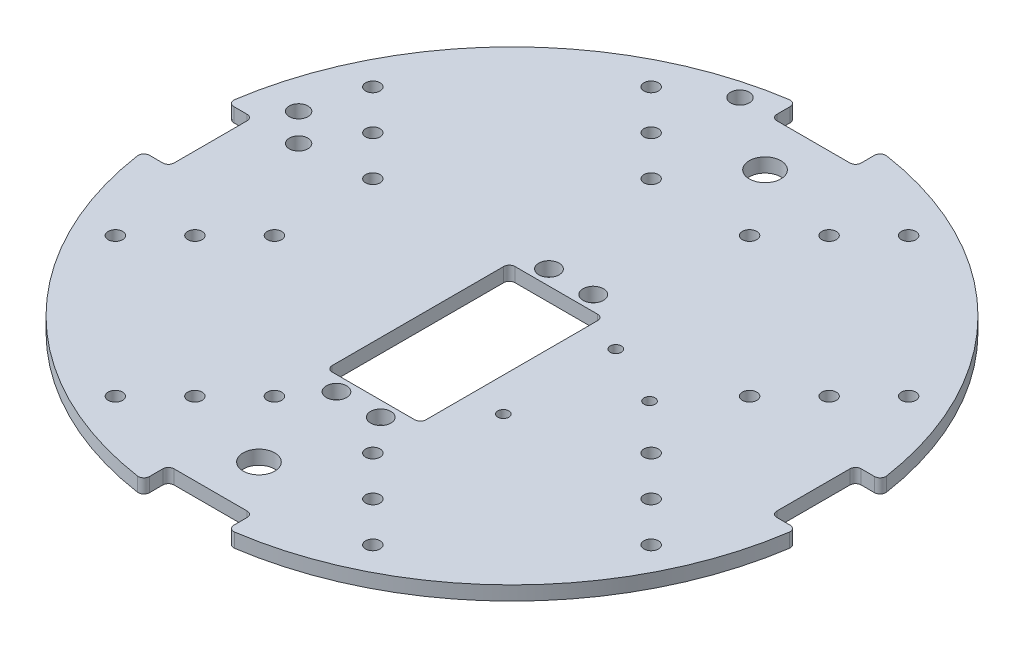
from build123d import *

# Parameters (mm, degrees)
SKETCH1_R                       = 74.422
SKETCH1_W                       = 21.200000018
SKETCH1_H                       = 41.29999995
BOSS_EXTRUDE1_DEPTH             = 3.175
F_4_6_4_6_DIAMETER_HOLE1_D      = 4.6
F_4_CLEARANCE_HOLE1_D           = 3.2639
CIRPATTERN2_COUNT               = 4
F_1_4_CLEARANCE_HOLE1_D         = 7.14248
SKETCH19_W                      = 19.05
SKETCH19_H                      = 12.7
CUT_EXTRUDE1_DEPTH              = 106.29648044
CIRPATTERN3_COUNT               = 4
FILLET1_R                       = 1.27
F_19_0_166_DIAMETER_HOLE1_D     = 4.2164
TAP_DRILL_FOR_M3X0_5_TAP1_D     = 2.5
TAP_DRILL_FOR_M3X0_5_TAP1_DEPTH = 3.81
TAP_DRILL_FOR_M3X0_5_TAP1_TIP   = 0.751075774


with BuildPart() as part:
    # Sketch1 → Boss-Extrude1 (new body)
    with BuildSketch(Plane(origin=(0, 0, 0), x_dir=(1, 0, 0), z_dir=(0, 1, 0))):
        with Locations(Location((0, 0, 0), (0, 0, 270))):
            Circle(SKETCH1_R)
        with Locations((0, -10.649999909)):
            Rectangle(SKETCH1_W, SKETCH1_H, mode=Mode.SUBTRACT)
    extrude(amount=BOSS_EXTRUDE1_DEPTH)

    # Ø4.6 (4.6) Diameter Hole1 (through all)
    with Locations(Plane(origin=(0, 0, 0), x_dir=(-1, 0, 0), z_dir=(0, -1, 0))):
        with Locations((-5.000000033, 13.350000097), (4.999999906, 13.350000097), (-5.000000033, -34.649999915), (4.999999906, -34.649999915)):
            Hole(F_4_6_4_6_DIAMETER_HOLE1_D / 2)

    # #4 Clearance Hole1 (through all)
    with Locations(Plane(origin=(0, 0, 0), x_dir=(-1, 0, 0), z_dir=(0, -1, 0))):
        with Locations((60.506475165, -29.075578741), (29.075578741, -60.506475165), (11.115066499, -42.545962923), (20.09532262, -51.526219044), (51.526219044, -20.09532262), (42.545962923, -11.115066499)):
            f_4_clearance_hole1 = Hole(F_4_CLEARANCE_HOLE1_D / 2)

    # CirPattern2: #4 Clearance Hole1 ×4 about axis
    cirpattern2_axis = Axis((0, 0, 0), (0, 1, 0))
    for i in range(1, CIRPATTERN2_COUNT):
        add(f_4_clearance_hole1.rotate(cirpattern2_axis, i * 360 / CIRPATTERN2_COUNT), mode=Mode.SUBTRACT)

    # 1/4 Clearance Hole1 (through all)
    with Locations(Plane(origin=(0, 3.175, 0), x_dir=(1, 0, 0), z_dir=(0, 1, 0))):
        with Locations((0, 57.15), (0, -57.15)):
            Hole(F_1_4_CLEARANCE_HOLE1_D / 2)

    # Sketch19 → Cut-Extrude1 (cut, through all)
    with BuildSketch(Plane.XZ):
        with Locations((0, -74.422)):
            Rectangle(SKETCH19_W, SKETCH19_H)
    cut_extrude1 = extrude(amount=-CUT_EXTRUDE1_DEPTH, mode=Mode.SUBTRACT)

    # CirPattern3: Cut-Extrude1 ×4 about axis
    cirpattern3_axis = Axis((0, 0, 0), (0, 1, 0))
    for i in range(1, CIRPATTERN3_COUNT):
        add(cut_extrude1.rotate(cirpattern3_axis, i * 360 / CIRPATTERN3_COUNT), mode=Mode.SUBTRACT)

    # Fillet1
    fillet1_edges = [part.edges().sort_by_distance(p)[0] for p in [
        (-9.525, 1.5875, -73.809948239),
        (9.525, 1.5875, -73.809948239),
        (9.525, 1.5875, -68.072),
        (-9.525, 1.5875, -68.072),
        (73.809948239, 1.5875, -9.525),
        (73.809948239, 1.5875, 9.525),
        (9.525, 1.5875, 73.809948239),
        (-9.525, 1.5875, 73.809948239),
        (-73.809948239, 1.5875, 9.525),
        (-73.809948239, 1.5875, -9.525),
        (-68.072, 1.5875, -9.525),
        (-68.072, 1.5875, 9.525),
        (-9.525, 1.5875, 68.072),
        (9.525, 1.5875, 68.072),
        (68.072, 1.5875, 9.525),
        (68.072, 1.5875, -9.525),
        (10.600000009, 1.5875, 31.299999884),
        (10.600000009, 1.5875, -10.000000066),
        (-10.600000009, 1.5875, -10.000000066),
        (-10.600000009, 1.5875, 31.299999884),
    ]]
    fillet(fillet1_edges, radius=FILLET1_R)

    # #19 (0.166) Diameter Hole1 (through all)
    with Locations(Plane(origin=(0, 3.175, 0), x_dir=(1, 0, 0), z_dir=(0, 1, 0))):
        with Locations((-16.963217712, 68.448703271), (-64.109562348, 15.914204963), (-57.823383063, 9.628025678)):
            Hole(F_19_0_166_DIAMETER_HOLE1_D / 2)

    # Tap Drill for M3x0.5 Tap1
    with Locations(Plane(origin=(0, 3.175, 0), x_dir=(1, 0, 0), z_dir=(0, 1, 0))):
        with Locations((18.220000103, 5.225000097), (18.220000103, -20.174999903), (32.190000103, -1.124999903)):
            Hole(TAP_DRILL_FOR_M3X0_5_TAP1_D / 2, depth=TAP_DRILL_FOR_M3X0_5_TAP1_DEPTH)
            with Locations((0, 0, -(TAP_DRILL_FOR_M3X0_5_TAP1_DEPTH + TAP_DRILL_FOR_M3X0_5_TAP1_TIP / 2))):  # 118° drill point
                Cone(0, TAP_DRILL_FOR_M3X0_5_TAP1_D / 2, TAP_DRILL_FOR_M3X0_5_TAP1_TIP, mode=Mode.SUBTRACT)


solid = part.part
